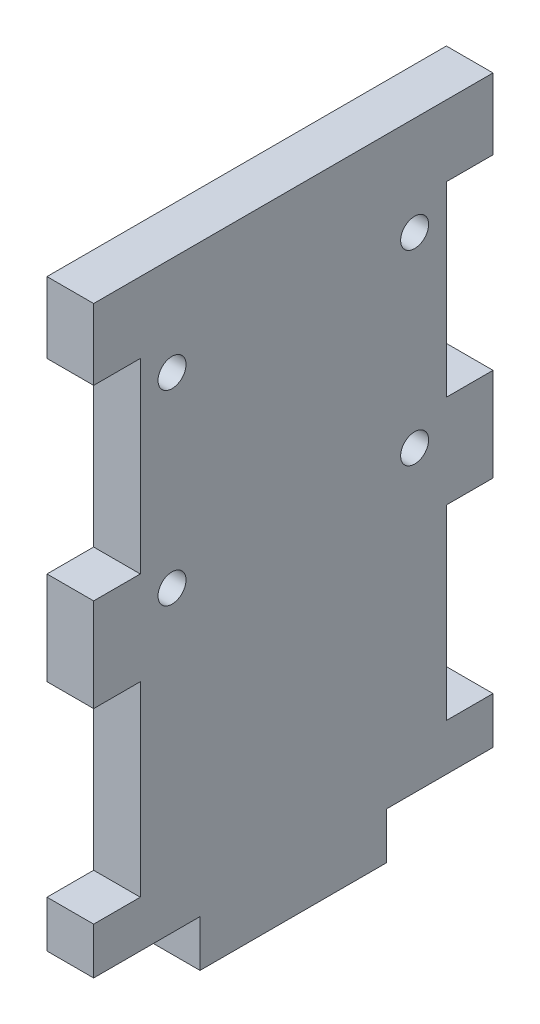
from build123d import *

# Parameters (mm, degrees)
SKETCH1_R      = 1.905
EXTRUDE1_DEPTH = 6.35


with BuildPart() as part:
    # Sketch1 → Extrude1 (new body)
    with BuildSketch(Plane(origin=(0, 0, 0), x_dir=(0, 0, -1), z_dir=(1, 0, 0))):
        Polygon((14.478, 0), (14.478, 6.35), (0, 6.35), (0, 12.7), (6.35, 12.7), (6.35, 38.1), (0, 38.1), (0, 50.8), (6.35, 50.8), (6.35, 76.2), (0, 76.2), (0, 85.852), (54.356, 85.852), (54.356, 76.2), (48.006, 76.2), (48.006, 50.8), (54.356, 50.8), (54.356, 38.1), (48.006, 38.1), (48.006, 12.7), (54.356, 12.7), (54.356, 6.35), (39.878, 6.35), (39.878, 0), align=None)
        with Locations((10.668, 72.39)):
            Circle(SKETCH1_R, mode=Mode.SUBTRACT)
        with Locations((43.688, 72.39)):
            Circle(SKETCH1_R, mode=Mode.SUBTRACT)
        with Locations((43.688, 46.99)):
            Circle(SKETCH1_R, mode=Mode.SUBTRACT)
        with Locations((10.668, 46.99)):
            Circle(SKETCH1_R, mode=Mode.SUBTRACT)
    extrude(amount=EXTRUDE1_DEPTH)


solid = part.part
